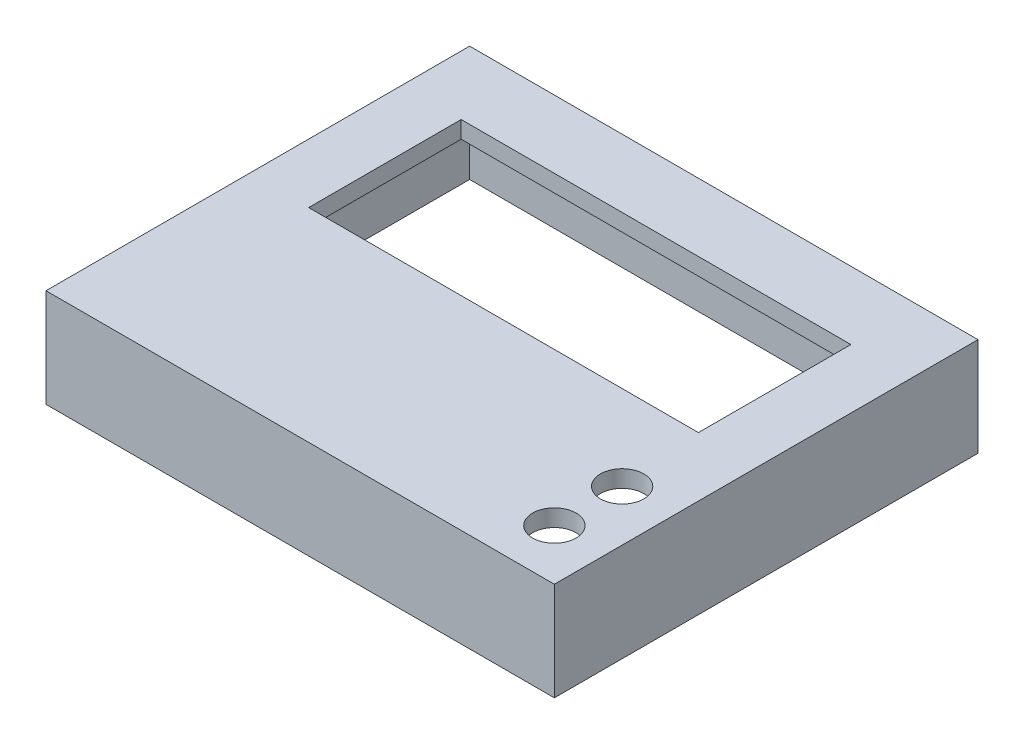
from build123d import *

# Parameters (mm, degrees)
SKETCH1_W           = 95.25
SKETCH1_H           = 79.375
SKETCH1_W_2         = 73.025
SKETCH1_H_2         = 28.575
BOSS_EXTRUDE1_DEPTH = 3.2
SKETCH2_W           = 95.25
SKETCH2_H           = 79.375
SKETCH2_W_2         = 88.85
SKETCH2_H_2         = 72.975
EXTRUDE_THIN1_DEPTH = 15.24
SKETCH3_R           = 4.064
CUT_EXTRUDE1_DEPTH  = 74.161631893


with BuildPart() as part:
    # Sketch1 → Boss-Extrude1 (new body)
    with BuildSketch(Plane(origin=(0, 0, 0), x_dir=(1, 0, 0), z_dir=(0, 1, 0))):
        with Locations((0, -12.7)):
            Rectangle(SKETCH1_W, SKETCH1_H)
        Rectangle(SKETCH1_W_2, SKETCH1_H_2, mode=Mode.SUBTRACT)
    extrude(amount=BOSS_EXTRUDE1_DEPTH)

    # Sketch2 → Extrude-Thin1 (add)
    with BuildSketch(Plane.XZ):
        with Locations((0, 12.7)):
            Rectangle(SKETCH2_W, SKETCH2_H)
        with Locations((0, 12.7)):
            Rectangle(SKETCH2_W_2, SKETCH2_H_2, mode=Mode.SUBTRACT)
    extrude(amount=EXTRUDE_THIN1_DEPTH)

    # Sketch3 → Cut-Extrude1 (cut, through all)
    with BuildSketch(Plane(origin=(0, 3.2, 0), x_dir=(1, 0, 0), z_dir=(0, 1, 0))):
        with Locations(Location((38.1, -30.1625, 0), (0, 0, 270))):
            Circle(SKETCH3_R)
        with Locations(Location((38.1, -42.8625, 0), (0, 0, 270))):
            Circle(SKETCH3_R)
    extrude(amount=-CUT_EXTRUDE1_DEPTH, mode=Mode.SUBTRACT)


solid = part.part
